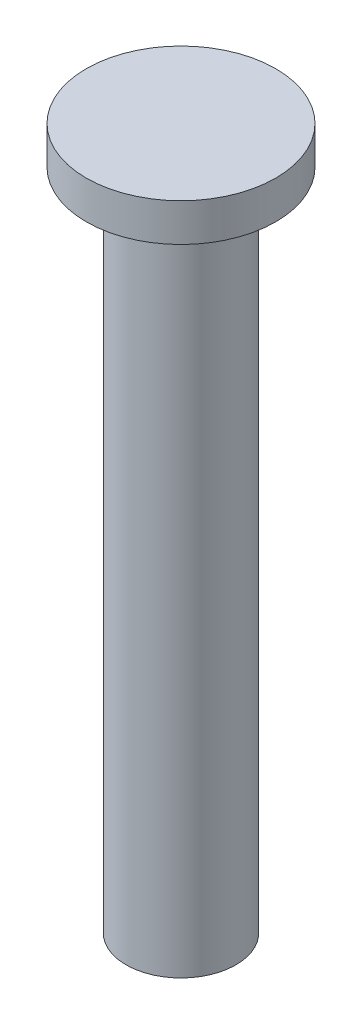
from build123d import *


with BuildPart() as part:
    # Sketch1 → Revolve1 (revolve)
    with BuildSketch(Plane.XY, mode=Mode.PRIVATE) as revolve1_sk:
        Polygon((0, 37), (5, 37), (5, 35), (2.9, 35), (2.9, 0), (0, 0), align=None)
    revolve(revolve1_sk.sketch.rotate(Axis((0, 0, 0), (0, 1, 0)), 90), axis=Axis((0, 0, 0), (0, 1, 0)))


solid = part.part
